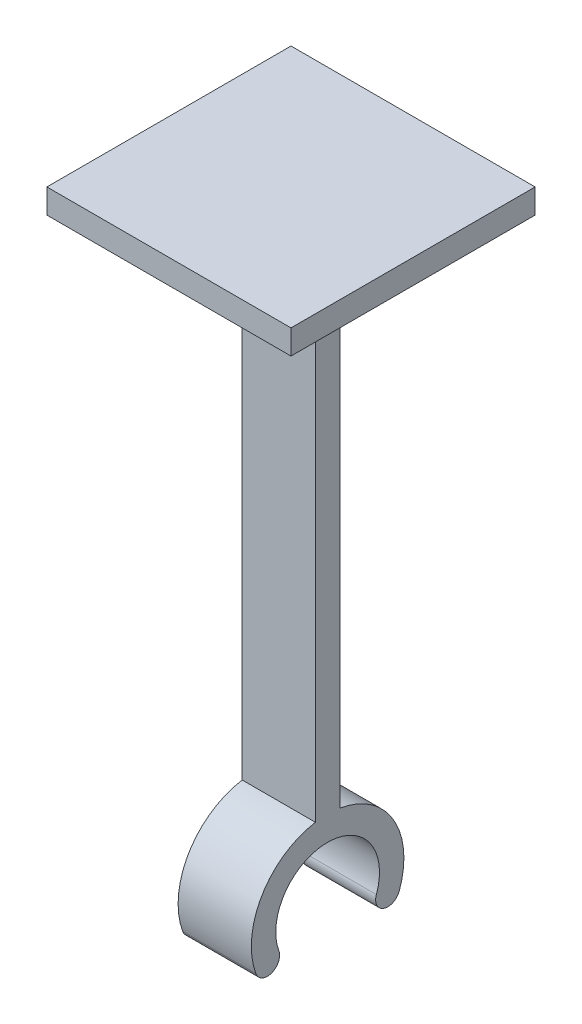
from build123d import *

# Parameters (mm, degrees)
BOSS_EXTRUDE1_DEPTH      = 3
BOSS_EXTRUDE1_DEPTH_BACK = 3
BOSS_EXTRUDE2_DEPTH      = 3
BOSS_EXTRUDE3_DEPTH      = 3
SKETCH4_W                = 20
SKETCH4_H                = 20
BOSS_EXTRUDE4_DEPTH      = 2


with BuildPart() as part:
    # Sketch1 → Boss-Extrude1 (new, two sides: drawn at the far end of the back side and taken through both)
    with BuildSketch(Plane(origin=(0, 0, 0), x_dir=(0, 0, -1), z_dir=(1, 0, 0)).offset(-BOSS_EXTRUDE1_DEPTH_BACK)):
        with BuildLine():
            ThreePointArc((-3.993693638, -1.453585609), (0, 4.25), (3.993693638, -1.453585609))
            ThreePointArc((3.993693638, -1.453585609), (4.591366116, -2.735298373), (5.87307888, -2.137625896))
            ThreePointArc((5.87307888, -2.137625896), (0, 6.25), (-5.87307888, -2.137625896))
            ThreePointArc((-5.87307888, -2.137625896), (-4.591366116, -2.735298373), (-3.993693638, -1.453585609))
        make_face()
    extrude(amount=BOSS_EXTRUDE1_DEPTH + BOSS_EXTRUDE1_DEPTH_BACK)

    # Sketch2 → Boss-Extrude2 (add)
    with BuildSketch(Plane(origin=(0, 0, 0), x_dir=(0, 0, -1), z_dir=(1, 0, 0))):
        Polygon((-1, 4.25), (0, 4.25), (1, 4.25), (1, 47.25), (-1, 47.25), align=None)
    extrude(amount=BOSS_EXTRUDE2_DEPTH)

    # Sketch3 → Boss-Extrude3 (add)
    with BuildSketch(Plane(origin=(0, 0, 0), x_dir=(0, 0, -1), z_dir=(1, 0, 0))):
        Polygon((1, 47.25), (0, 47.25), (-1, 47.25), (-1, 4.25), (1, 4.25), align=None)
    extrude(amount=-BOSS_EXTRUDE3_DEPTH)

    # Sketch4 → Boss-Extrude4 (add)
    with BuildSketch(Plane(origin=(0, 47.25, 0), x_dir=(1, 0, 0), z_dir=(0, 1, 0))):
        Rectangle(SKETCH4_W, SKETCH4_H)
    extrude(amount=BOSS_EXTRUDE4_DEPTH)


solid = part.part
